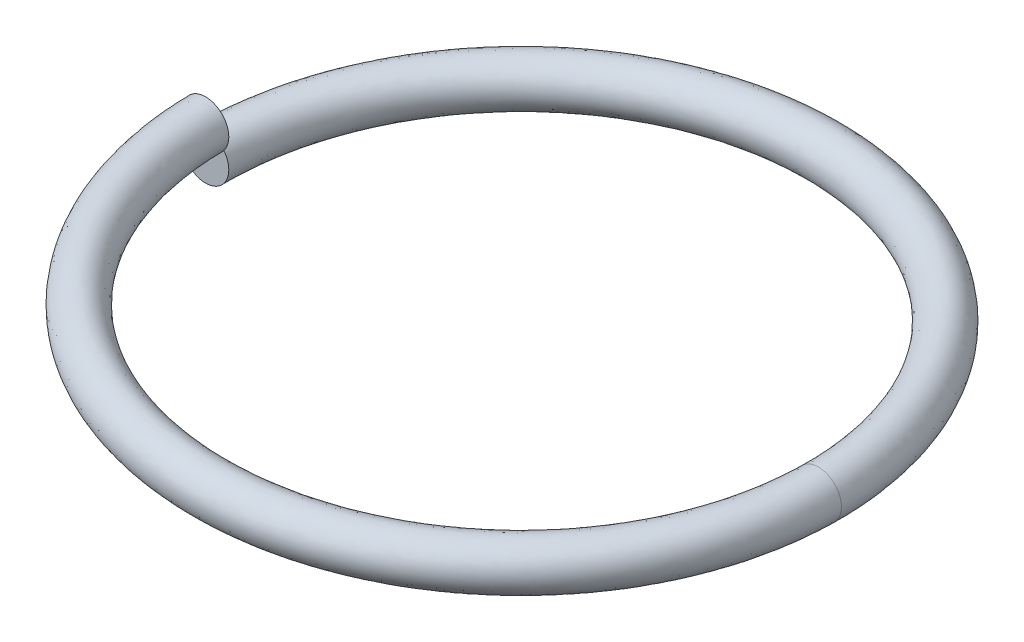
from build123d import *

# Parameters (mm, degrees)
BARRER1_PITCH       = 0.8
BARRER1_HEIGHT      = 0.8
BARRER1_RADIUS      = 8.6
BARRER1_START_ANGLE = -90
CROQUIS2_R          = 0.65


with BuildPart() as part:
    # Barrer1: sweep along a helix
    with BuildLine() as barrer1_path:
        add(Helix(BARRER1_PITCH, BARRER1_HEIGHT, BARRER1_RADIUS, center=(0, 0, 0), direction=(0, 1, 0), lefthand=True, mode=Mode.PRIVATE).rotate(Axis((0, 0, 0), (0, 1, 0)), BARRER1_START_ANGLE))
    # Croquis2 → Barrer1 (sweep)
    with BuildSketch(Plane.XY):
        with Locations((-8.6, 0)):
            Circle(CROQUIS2_R)
    sweep(path=barrer1_path.line, is_frenet=True)


solid = part.part
